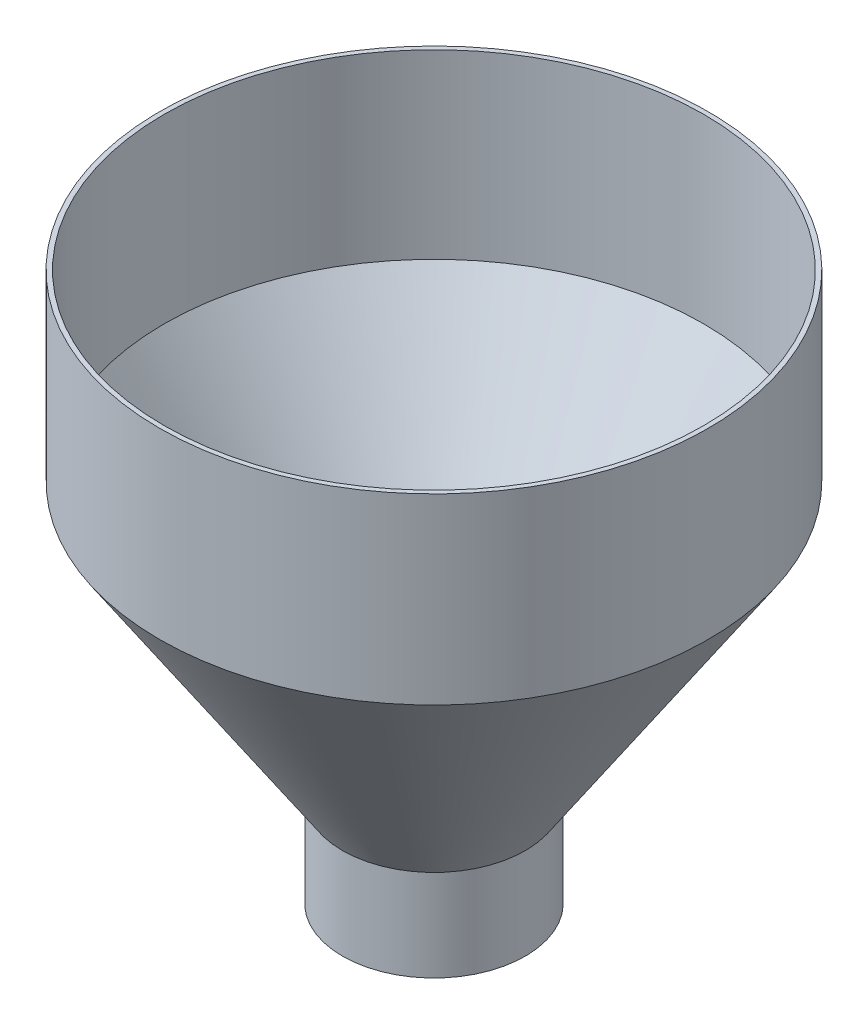
from build123d import *

# Parameters (mm, degrees)
SKETCH1_W   = 40
SKETCH1_H   = 120
SKETCH1_H_2 = 80
SKETCH1_W_2 = 80
SKETCH1_H_3 = 40
SHELL2_T    = -2


with BuildPart() as part:
    # Sketch1 → Revolve3 (revolve)
    with BuildSketch(Plane.XY, mode=Mode.PRIVATE) as revolve3_sk:
        with Locations((-20, 100)):
            Rectangle(SKETCH1_W, SKETCH1_H)
        with Locations((-20, 200)):
            Rectangle(SKETCH1_W, SKETCH1_H_2)
        with Locations((-80, 200)):
            Rectangle(SKETCH1_W_2, SKETCH1_H_2)
        Polygon((-40, 160), (-120, 160), (-40, 40), align=None)
        with Locations((-20, 20)):
            Rectangle(SKETCH1_W, SKETCH1_H_3)
    revolve(revolve3_sk.sketch.rotate(Axis((0, 249.803796798, 0), (0, -1, 0)), 270), axis=Axis((0, 249.803796798, 0), (0, -1, 0)))

    # Shell2
    shell2_openings = [part.faces().sort_by_distance(p)[0] for p in [
        (0, 240, 0),
        (0, 0, 0),
    ]]
    offset(amount=SHELL2_T, openings=shell2_openings, kind=Kind.INTERSECTION)


solid = part.part
